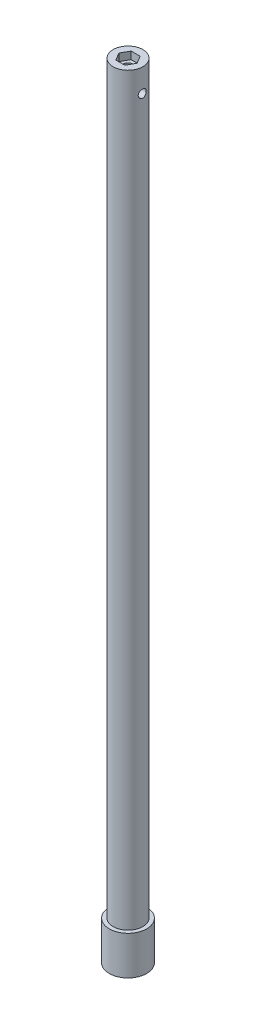
from build123d import *

# Parameters (mm, degrees)
SKETCH1_R               = 5
BOSS_EXTRUDE1_DEPTH     = 104.75
SKETCH5_R               = 5
SKETCH5_R_2             = 3.975
CUT_EXTRUDE3_DEPTH      = 199.15
CUT_EXTRUDE4_DEPTH      = 2
CUT_EXTRUDE5_DEPTH      = 2
SKETCH11_R              = 1.3
CUT_EXTRUDE6_DEPTH      = 1
CUT_EXTRUDE7_START      = -1
SKETCH12_R              = 1.3
CUT_EXTRUDE7_DEPTH      = 1
CUT_EXTRUDE8_DEPTH      = 105.988392216
CUT_EXTRUDE8_DEPTH_BACK = 105.988392216
SKETCH13_R              = 1.065


with BuildPart() as part:
    # Sketch1 → Boss-Extrude1 (new, symmetric)
    with BuildSketch(Plane(origin=(0, 0, 0), x_dir=(1, 0, 0), z_dir=(0, 1, 0))):
        with Locations(Location((0, 0, 0), (0, 0, 270))):
            Circle(SKETCH1_R)
    extrude(amount=BOSS_EXTRUDE1_DEPTH, both=True)

    # Sketch5 → Cut-Extrude3 (cut)
    with BuildSketch(Plane(origin=(0, 104.75, 0), x_dir=(1, 0, 0), z_dir=(0, 1, 0))):
        with Locations(Location((0, 0, 0), (0, 0, 270))):
            Circle(SKETCH5_R)
        with Locations(Location((0, 0, 0), (0, 0, 270))):
            Circle(SKETCH5_R_2, mode=Mode.SUBTRACT)
    extrude(amount=-CUT_EXTRUDE3_DEPTH, mode=Mode.SUBTRACT)

    # Sketch8 → Cut-Extrude4 (cut)
    with BuildSketch(Plane(origin=(0, 104.75, 0), x_dir=(1, 0, 0), z_dir=(0, 1, 0))):
        Polygon((1.173959492, 2.088696351), (-1.221884355, 2.061026918), (-2.395843846, -0.027669433), (-1.173959492, -2.088696351), (1.221884355, -2.061026918), (2.395843846, 0.027669433), align=None)
    extrude(amount=-CUT_EXTRUDE4_DEPTH, mode=Mode.SUBTRACT)

    # Sketch10 → Cut-Extrude5 (cut)
    with BuildSketch(Plane.XZ.offset(104.75)):
        Polygon((0, 2.396003617), (-2.075, 1.198001809), (-2.075, -1.198001809), (0, -2.396003617), (2.075, -1.198001809), (2.075, 1.198001809), align=None)
    extrude(amount=-CUT_EXTRUDE5_DEPTH, mode=Mode.SUBTRACT)

    # Sketch11 → Cut-Extrude6 (cut)
    with BuildSketch(Plane.XZ.offset(102.75)):
        with Locations(Location((0, 0, 0), (0, 0, 270))):
            Circle(SKETCH11_R)
    extrude(amount=-CUT_EXTRUDE6_DEPTH, mode=Mode.SUBTRACT)

    # Sketch12 → Cut-Extrude7 (cut)
    with BuildSketch(Plane(origin=(0, 102.75, 0), x_dir=(1, 0, 0), z_dir=(0, 1, 0)).offset(CUT_EXTRUDE7_START)):
        with Locations(Location((0, 0, 0), (0, 0, 90))):
            Circle(SKETCH12_R)
    extrude(amount=CUT_EXTRUDE7_DEPTH, mode=Mode.SUBTRACT)

    # Sketch13 → Cut-Extrude8 (cut, two sides: drawn at the far end of the back side and taken through both)
    with BuildSketch(Plane(origin=(0, 0, 0), x_dir=(0, 0, -1), z_dir=(1, 0, 0)).offset(-CUT_EXTRUDE8_DEPTH_BACK)):
        with Locations(Location((-0.027669433, 98.55, 0), (0, 0, 180))):
            Circle(SKETCH13_R)
    extrude(amount=CUT_EXTRUDE8_DEPTH + CUT_EXTRUDE8_DEPTH_BACK, mode=Mode.SUBTRACT)


solid = part.part
